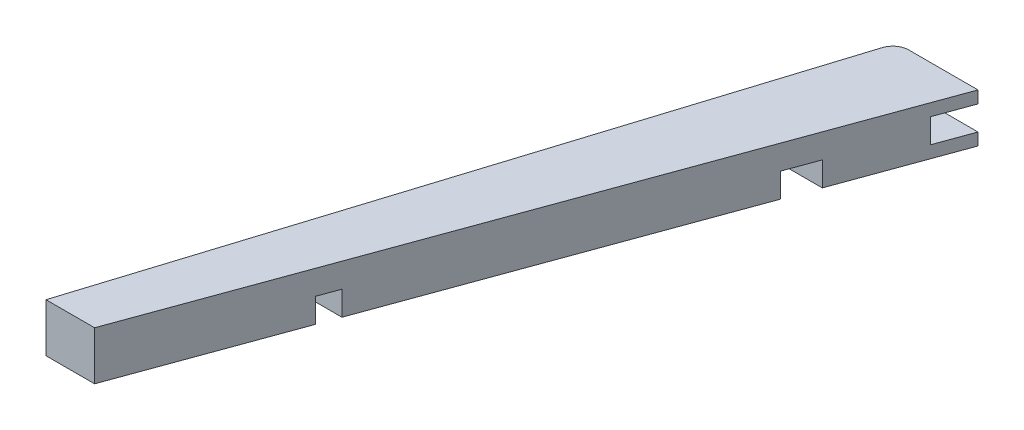
from build123d import *

# Parameters (mm, degrees)
SALIENTE_EXTRUIR1_DEPTH = 15
CROQUIS2_W              = 25
CROQUIS2_H              = 15
CORTAR_EXTRUIR1_DEPTH   = 21.55
REDONDEO2_R             = 10
CROQUIS5_W              = 40
CROQUIS5_H              = 12
CROQUIS5_H_2            = 19
CORTAR_EXTRUIR3_DEPTH   = 15


with BuildPart() as part:
    # Croquis1 → Saliente-Extruir1 (new, symmetric)
    with BuildSketch(Plane(origin=(0, 0, 0), x_dir=(1, 0, 0), z_dir=(0, 1, 0))):
        Polygon((15, 0), (160.588093706, 400), (110.588093706, 400), (-15, 0), align=None)
    extrude(amount=SALIENTE_EXTRUIR1_DEPTH, both=True)

    # Croquis2 → Cortar-Extruir1 (cut)
    with BuildSketch(Plane(origin=(0, 0, -400), x_dir=(-1, 0, 0), z_dir=(0, 0, -1))):
        with Locations((-148.088093706, 0)):
            Rectangle(CROQUIS2_W, CROQUIS2_H)
    extrude(amount=-CORTAR_EXTRUIR1_DEPTH, mode=Mode.SUBTRACT)

    # Redondeo2
    redondeo2_edges = [part.edges().sort_by_distance(p)[0] for p in [
        (110.588093706, 0, -400),
    ]]
    fillet(redondeo2_edges, radius=REDONDEO2_R)

    # Croquis5 → Cortar-Extruir3 (cut)
    with BuildSketch(Plane.XZ.offset(15)):
        with Locations((53.580844832, -106)):
            Rectangle(CROQUIS5_W, CROQUIS5_H)
        with Locations((131.470474965, -320)):
            Rectangle(CROQUIS5_W, CROQUIS5_H_2)
    extrude(amount=-CORTAR_EXTRUIR3_DEPTH, mode=Mode.SUBTRACT)


solid = part.part
